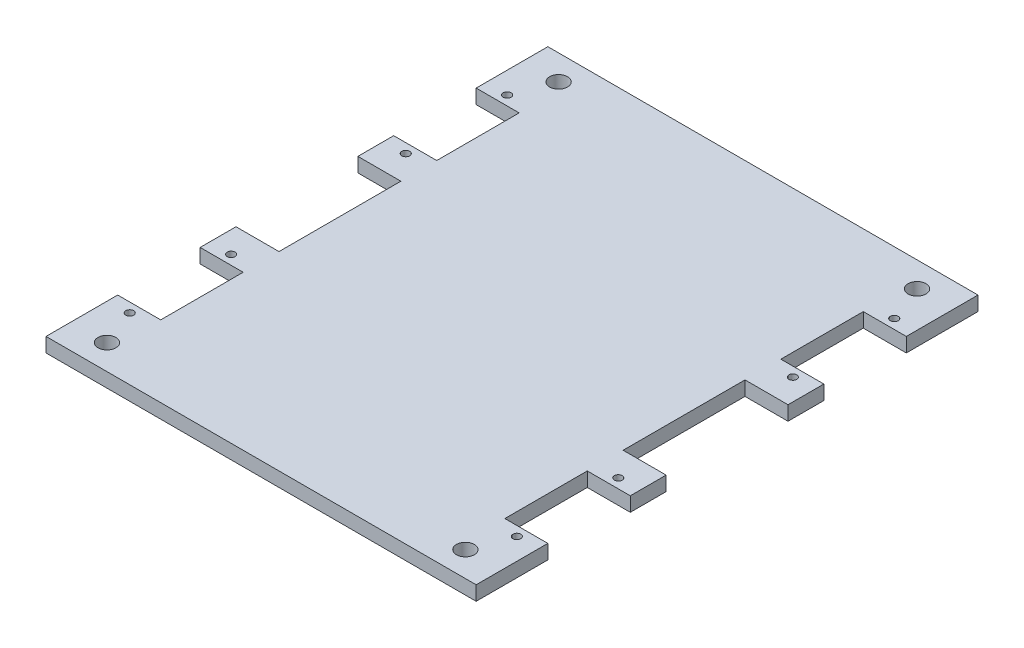
from build123d import *

# Parameters (mm, degrees)
SKETCH1_W           = 120
SKETCH1_H           = 140
BOSS_EXTRUDE1_DEPTH = 4
SKETCH2_W           = 12
SKETCH2_H           = 23
SKETCH2_H_2         = 34
SKETCH2_R           = 1.1
SKETCH2_R_2         = 2.5
CUT_EXTRUDE1_DEPTH  = 93.28217596


with BuildPart() as part:
    # Sketch1 → Boss-Extrude1 (new body)
    with BuildSketch(Plane(origin=(0, 0, 0), x_dir=(1, 0, 0), z_dir=(0, 1, 0))):
        Rectangle(SKETCH1_W, SKETCH1_H)
    extrude(amount=BOSS_EXTRUDE1_DEPTH)

    # Sketch2 → Cut-Extrude1 (cut, through all)
    with BuildSketch(Plane(origin=(0, 4, 0), x_dir=(1, 0, 0), z_dir=(0, 1, 0))):
        with Locations((54, 38.5)):
            Rectangle(SKETCH2_W, SKETCH2_H)
        with Locations((-54, 38.5)):
            Rectangle(SKETCH2_W, SKETCH2_H)
        with Locations((54, -38.5)):
            Rectangle(SKETCH2_W, SKETCH2_H)
        with Locations((-54, -38.5)):
            Rectangle(SKETCH2_W, SKETCH2_H)
        with Locations((-54, 0)):
            Rectangle(SKETCH2_W, SKETCH2_H_2)
        with Locations((54, 0)):
            Rectangle(SKETCH2_W, SKETCH2_H_2)
        with Locations(Location((-54, 52.65, 0), (0, 0, 270))):
            Circle(SKETCH2_R)
        with Locations(Location((-54, 24.35, 0), (0, 0, 270))):
            Circle(SKETCH2_R)
        with Locations(Location((-54, -24.35, 0), (0, 0, 270))):
            Circle(SKETCH2_R)
        with Locations(Location((-54, -52.65, 0), (0, 0, 270))):
            Circle(SKETCH2_R)
        with Locations(Location((54, 52.65, 0), (0, 0, 270))):
            Circle(SKETCH2_R)
        with Locations(Location((54, 24.35, 0), (0, 0, 270))):
            Circle(SKETCH2_R)
        with Locations(Location((54, -24.35, 0), (0, 0, 270))):
            Circle(SKETCH2_R)
        with Locations(Location((54, -52.65, 0), (0, 0, 270))):
            Circle(SKETCH2_R)
        with Locations(Location((-50, 63, 0), (0, 0, 270))):
            Circle(SKETCH2_R_2)
        with Locations(Location((50, 63, 0), (0, 0, 270))):
            Circle(SKETCH2_R_2)
        with Locations(Location((50, -63, 0), (0, 0, 270))):
            Circle(SKETCH2_R_2)
        with Locations(Location((-50, -63, 0), (0, 0, 270))):
            Circle(SKETCH2_R_2)
    extrude(amount=-CUT_EXTRUDE1_DEPTH, mode=Mode.SUBTRACT)


solid = part.part
